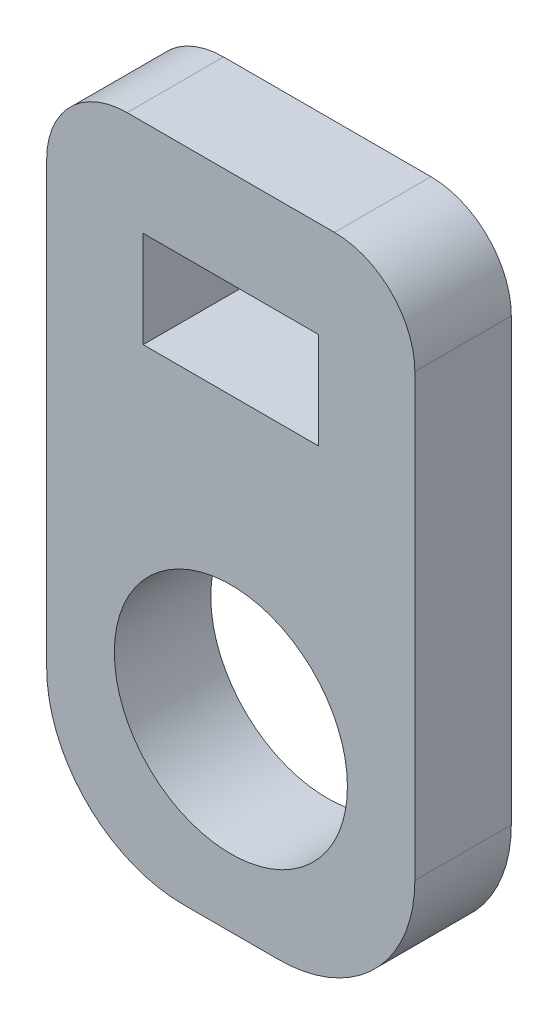
from build123d import *

# Parameters (mm, degrees)
SKETCH1_W               = 58.166
SKETCH1_H               = 103.919999932
BOSS_EXTRUDE1_DEPTH     = 15.24
SKETCH2_W               = 27.686
SKETCH2_H               = 15.24
CUT_EXTRUDE1_DEPTH      = 121.06209869
CUT_EXTRUDE2_DEPTH      = 121.06209869
CUT_EXTRUDE2_DEPTH_BACK = 121.06209869
SKETCH7_R               = 18.415
FILLET2_R               = 21.59
FILLET3_R               = 12.7


with BuildPart() as part:
    # Sketch1 → Boss-Extrude1 (new body)
    with BuildSketch(Plane.XY):
        with Locations((29.083, 51.959999966)):
            Rectangle(SKETCH1_W, SKETCH1_H)
    extrude(amount=BOSS_EXTRUDE1_DEPTH)

    # Sketch2 → Cut-Extrude1 (cut, through all)
    with BuildSketch(Plane.XY.offset(15.24)):
        with Locations((29.083, 81.059999932)):
            Rectangle(SKETCH2_W, SKETCH2_H)
    extrude(amount=-CUT_EXTRUDE1_DEPTH, mode=Mode.SUBTRACT)

    # Sketch7 → Cut-Extrude2 (cut, two sides: drawn at the far end of the back side and taken through both)
    with BuildSketch(Plane.XY.offset(15.24).offset(-CUT_EXTRUDE2_DEPTH_BACK)):
        with Locations((29.099999966, 29.1)):
            Circle(SKETCH7_R)
    extrude(amount=CUT_EXTRUDE2_DEPTH + CUT_EXTRUDE2_DEPTH_BACK, mode=Mode.SUBTRACT)

    # Fillet2
    fillet2_edges = [part.edges().sort_by_distance(p)[0] for p in [
        (58.166, 0, 7.62),
        (0, 0, 7.62),
    ]]
    fillet(fillet2_edges, radius=FILLET2_R)

    # Fillet3
    fillet3_edges = [part.edges().sort_by_distance(p)[0] for p in [
        (0, 103.919999932, 7.62),
        (58.166, 103.919999932, 7.62),
    ]]
    fillet(fillet3_edges, radius=FILLET3_R)


solid = part.part
